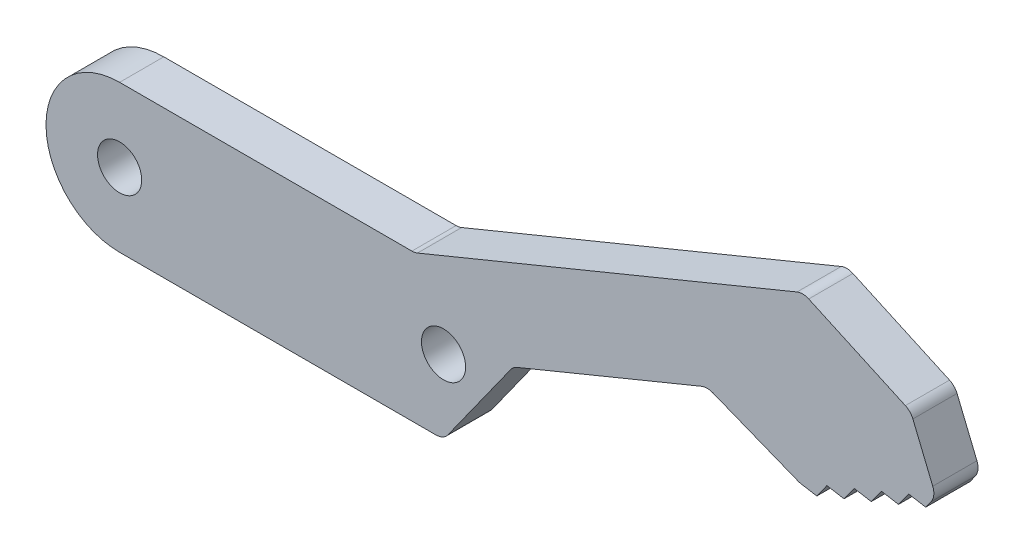
from build123d import *

# Parameters (mm, degrees)
SKETCH1_R           = 1.5
BOSS_EXTRUDE1_DEPTH = 3
FILLET1_R           = 1


with BuildPart() as part:
    # Sketch1 → Boss-Extrude1 (new body)
    with BuildSketch(Plane.XY):
        with BuildLine():
            Line((20.05, 5), (0, 5))
            ThreePointArc((0, 5), (-5, 0), (0, -5))
            Line((0, -5), (22, -5))
            Line((22, -5), (26.72989842, 1.621129525))
            Line((26.72989842, 1.621129525), (39.900164389, 7.036080522))
            Line((39.900164389, 7.036080522), (46.188488025, 4.540007042))
            Line((46.188488025, 4.540007042), (47.351030887, 4.342221563))
            Line((47.351030887, 4.342221563), (48.038244482, 5.300533868))
            Line((48.038244482, 5.300533868), (49.200787343, 5.102748388))
            Line((49.200787343, 5.102748388), (49.888000938, 6.061060693))
            Line((49.888000938, 6.061060693), (51.050543799, 5.863275214))
            Line((51.050543799, 5.863275214), (51.737757394, 6.821587519))
            Line((51.737757394, 6.821587519), (52.900300256, 6.623802039))
            Line((52.900300256, 6.623802039), (53.587513851, 7.582114344))
            Line((53.587513851, 7.582114344), (54.750056712, 7.384328864))
            Line((54.750056712, 7.384328864), (55.437270307, 8.34264117))
            Line((55.437270307, 8.34264117), (53.72608495, 12.504593197))
            Line((53.72608495, 12.504593197), (46.409029503, 15.837507263))
            Line((46.409029503, 15.837507263), (20.05, 5))
        make_face()
        Circle(SKETCH1_R, mode=Mode.SUBTRACT)
        with Locations((22, 0)):
            Circle(SKETCH1_R, mode=Mode.SUBTRACT)
    extrude(amount=BOSS_EXTRUDE1_DEPTH)

    # Fillet1
    fillet1_edges = [part.edges().sort_by_distance(p)[0] for p in [
        (22, -5, 1.5),
        (20.05, 5, 1.5),
        (46.409029503, 15.837507263, 1.5),
        (53.72608495, 12.504593197, 1.5),
        (55.437270307, 8.34264117, 1.5),
        (46.188488025, 4.540007042, 1.5),
        (39.900164389, 7.036080522, 1.5),
        (26.72989842, 1.621129525, 1.5),
    ]]
    fillet(fillet1_edges, radius=FILLET1_R)


solid = part.part
